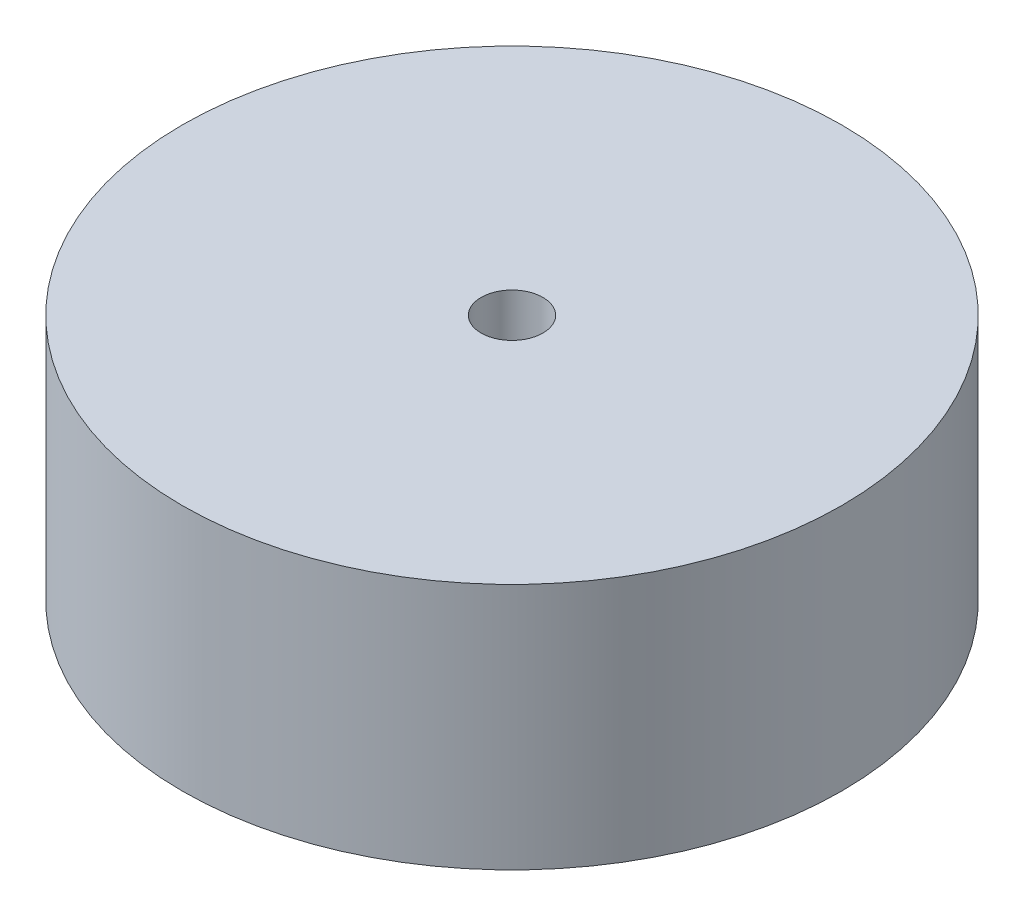
from build123d import *

# Parameters (mm, degrees)
SKETCH1_R           = 101.6
BOSS_EXTRUDE1_DEPTH = 76.2
SKETCH2_R           = 9.525
CUT_EXTRUDE1_DEPTH  = 163.639355631


with BuildPart() as part:
    # Sketch1 → Boss-Extrude1 (new body)
    with BuildSketch(Plane(origin=(0, 0, 0), x_dir=(1, 0, 0), z_dir=(0, 1, 0))):
        with Locations(Location((0, 0, 0), (0, 0, 90))):
            Circle(SKETCH1_R)
    extrude(amount=BOSS_EXTRUDE1_DEPTH)

    # Sketch2 → Cut-Extrude1 (cut, through all)
    with BuildSketch(Plane(origin=(0, 76.2, 0), x_dir=(1, 0, 0), z_dir=(0, 1, 0))):
        with Locations(Location((0, 0, 0), (0, 0, 270))):
            Circle(SKETCH2_R)
    extrude(amount=-CUT_EXTRUDE1_DEPTH, mode=Mode.SUBTRACT)


solid = part.part
